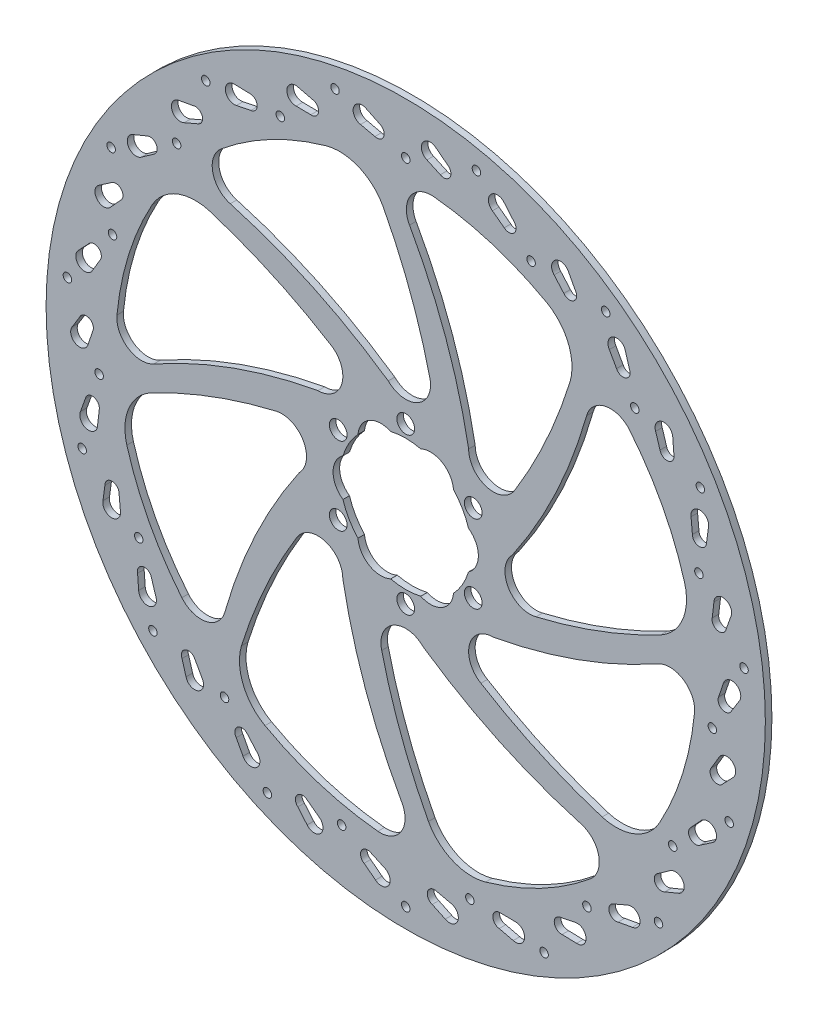
from build123d import *

# Parameters (mm, degrees)
SKETCH1_R      = 101.5
SKETCH1_R_2    = 1.2
SKETCH1_R_3    = 2.5
EXTRUDE1_DEPTH = 1.85


with BuildPart() as part:
    # Sketch1 → Extrude1 (new body)
    with BuildSketch(Plane.XY):
        Circle(SKETCH1_R)
        with Locations((-71.341911819, -64.236540578)):
            Circle(SKETCH1_R_2, mode=Mode.SUBTRACT)
        with Locations((-51.137316949, -70.384478511)):
            Circle(SKETCH1_R_2, mode=Mode.SUBTRACT)
        with BuildLine():
            Line((-61.998078989, -70.824326541), (-63.142973621, -66.919550578))
            ThreePointArc((-63.142973621, -66.919550578), (-62.141111954, -64.27450366), (-59.496065036, -65.276365326))
            Line((-59.496065036, -65.276365326), (-57.459092502, -68.897958465))
            ThreePointArc((-57.459092502, -68.897958465), (-58.475442576, -72.491803952), (-61.927280322, -71.06579237))
            ThreePointArc((-61.927280322, -71.06579237), (-61.965719597, -70.945950777), (-61.998078989, -70.824326541))
        make_face(mode=Mode.SUBTRACT)
        with BuildLine():
            Line((-75.368477695, -56.38651965), (-75.67650506, -52.329035431))
            ThreePointArc((-75.67650506, -52.329035431), (-74.146600297, -49.950087887), (-71.767652754, -51.479992649))
            Line((-71.767652754, -51.479992649), (-70.528164509, -55.445955693))
            ThreePointArc((-70.528164509, -55.445955693), (-72.269507387, -58.749955971), (-75.349429718, -56.637428741))
            ThreePointArc((-75.349429718, -56.637428741), (-75.362112534, -56.512214001), (-75.368477695, -56.38651965))
        make_face(mode=Mode.SUBTRACT)
        with Locations((-39.046724604, -87.700369583)):
            Circle(SKETCH1_R_2, mode=Mode.SUBTRACT)
        with BuildLine():
            Line((-45.918066731, -82.16677051), (-47.849791241, -78.585360248))
            ThreePointArc((-47.849791241, -78.585360248), (-47.419758833, -75.789815199), (-44.624213783, -76.219847607))
            Line((-44.624213783, -76.219847607), (-41.878782433, -79.338789842))
            ThreePointArc((-41.878782433, -79.338789842), (-42.125720327, -83.065412245), (-45.798611616, -82.38823986))
            ThreePointArc((-45.798611616, -82.38823986), (-45.861127369, -82.279009069), (-45.918066731, -82.16677051))
        make_face(mode=Mode.SUBTRACT)
        with BuildLine():
            Line((-27.831214617, -89.918132327), (-30.465343375, -86.816612582))
            ThreePointArc((-30.465343375, -86.816612582), (-30.625934705, -83.992748134), (-27.802070257, -83.832156804))
            Line((-27.802070257, -83.832156804), (-24.468168615, -86.312135394))
            ThreePointArc((-24.468168615, -86.312135394), (-23.934901959, -90.008663432), (-27.668323816, -90.109925926))
            ThreePointArc((-27.668323816, -90.109925926), (-27.752183808, -90.016079845), (-27.831214617, -89.918132327))
        make_face(mode=Mode.SUBTRACT)
        with Locations((-3.977e-06, -96.000007955)):
            Circle(SKETCH1_R_2, mode=Mode.SUBTRACT)
        with BuildLine():
            Line((-8.528004876, -93.739640287), (-11.749413815, -91.253562353))
            ThreePointArc((-11.749413815, -91.253562353), (-12.493610271, -88.524794934), (-9.764842851, -87.780598478))
            Line((-9.764842851, -87.780598478), (-5.988178417, -89.513226458))
            ThreePointArc((-5.988178417, -89.513226458), (-4.698013522, -93.018104117), (-8.328797499, -93.893375834))
            ThreePointArc((-8.328797499, -93.893375834), (-8.430336646, -93.819015988), (-8.528004876, -93.739640287))
        make_face(mode=Mode.SUBTRACT)
        with Locations((-18.088317101, -85.098841264)):
            Circle(SKETCH1_R_2, mode=Mode.SUBTRACT)
        with Locations((-91.301434359, -29.665630135)):
            Circle(SKETCH1_R_2, mode=Mode.SUBTRACT)
        with BuildLine():
            Line((-85.444912268, -39.484351277), (-84.902610091, -35.451490333))
            ThreePointArc((-84.902610091, -35.451490333), (-82.911526413, -33.442613587), (-80.902649666, -35.433697266))
            Line((-80.902649666, -35.433697266), (-80.514817296, -39.570698598))
            ThreePointArc((-80.514817296, -39.570698598), (-82.905047939, -42.440453001), (-85.478447469, -39.7337377))
            ThreePointArc((-85.478447469, -39.7337377), (-85.464819526, -39.608622296), (-85.444912268, -39.484351277))
        make_face(mode=Mode.SUBTRACT)
        with Locations((-75.344210129, -43.5)):
            Circle(SKETCH1_R_2, mode=Mode.SUBTRACT)
        with BuildLine():
            Line((-91.786994165, -20.856527287), (-90.418063654, -17.024544993))
            ThreePointArc((-90.418063654, -17.024544993), (-88.05282097, -15.473536598), (-86.501812575, -17.838779282))
            Line((-86.501812575, -17.838779282), (-86.982586214, -21.966012093))
            ThreePointArc((-86.982586214, -21.966012093), (-89.917240072, -24.276098583), (-91.871646894, -21.093491658))
            ThreePointArc((-91.871646894, -21.093491658), (-91.832303799, -20.973943734), (-91.786994165, -20.856527287))
        make_face(mode=Mode.SUBTRACT)
        with BuildLine():
            Line((-94.117543974, -1.317172973), (-91.981813961, 2.146454656))
            ThreePointArc((-91.981813961, 2.146454656), (-89.345784727, 3.171808191), (-88.320431192, 0.535778957))
            Line((-88.320431192, 0.535778957), (-89.648798725, -3.401305455))
            ThreePointArc((-89.648798725, -3.401305455), (-92.999617344, -5.050762167), (-94.2496145, -1.531358813))
            ThreePointArc((-94.2496145, -1.531358813), (-94.186275736, -1.422603187), (-94.117543974, -1.317172973))
        make_face(mode=Mode.SUBTRACT)
        with Locations((-86.523404897, -9.093976304)):
            Circle(SKETCH1_R_2, mode=Mode.SUBTRACT)
        with BuildLine():
            ThreePointArc((-51.044949255, -49.522858535), (-56.342570087, -54.471101417), (-63.183389209, -52.072541881))
            ThreePointArc((-63.183389209, -52.072541881), (-72.466897056, -38.108255286), (-78.710796809, -22.545526287))
            ThreePointArc((-78.710796809, -22.545526287), (-78.170211393, -13.29412178), (-71.969304687, -6.407215801))
            ThreePointArc((-71.969304687, -6.407215801), (-54.777609064, 1.292105638), (-36.75649861, 6.776039177))
            ThreePointArc((-36.75649861, 6.776039177), (-28.923584542, 3.475240148), (-30.050244577, -4.949749715))
            ThreePointArc((-30.050244577, -4.949749715), (-42.39020698, -26.368402936), (-51.044949255, -49.522858535))
        make_face(mode=Mode.SUBTRACT)
        with BuildLine():
            ThreePointArc((-30.782152671, -21.199386168), (-22.909428641, -17.99469689), (-17.748730128, -24.748733305))
            ThreePointArc((-17.748730128, -24.748733305), (-11.329126286, -48.619679336), (-1.07628067, -71.112178857))
            ThreePointArc((-1.07628067, -71.112178857), (-1.323328187, -78.357098569), (-7.85655549, -81.498250445))
            ThreePointArc((-7.85655549, -81.498250445), (-24.295228587, -78.188440052), (-39.714843653, -71.599032699))
            ThreePointArc((-39.714843653, -71.599032699), (-45.874322902, -64.675050223), (-46.359397641, -55.420569123))
            ThreePointArc((-46.359397641, -55.420569123), (-39.647275485, -37.819962167), (-30.782152671, -21.199386168))
        make_face(mode=Mode.SUBTRACT)
        with Locations((-19.052551994, -10.999996023)):
            Circle(SKETCH1_R_3, mode=Mode.SUBTRACT)
        with BuildLine():
            Line((11.1479196, -93.464276153), (7.480021509, -91.702293567))
            ThreePointArc((7.480021509, -91.702293567), (6.184744883, -89.187883406), (8.699155044, -87.892606779))
            Line((8.699155044, -87.892606779), (12.753523912, -88.802159994))
            ThreePointArc((12.753523912, -88.802159994), (14.744200648, -91.962207302), (11.374737236, -93.573234667))
            ThreePointArc((11.374737236, -93.573234667), (11.259956682, -93.521610938), (11.1479196, -93.464276153))
        make_face(mode=Mode.SUBTRACT)
        with Locations((18.088317101, -85.098841264)):
            Circle(SKETCH1_R_2, mode=Mode.SUBTRACT)
        with BuildLine():
            Line((30.336626496, -89.104074661), (26.382544, -88.143194515))
            ThreePointArc((26.382544, -88.143194515), (24.592797008, -85.953033402), (26.782958121, -84.16328641))
            Line((26.782958121, -84.16328641), (30.937836048, -84.210013017))
            ThreePointArc((30.937836048, -84.210013017), (33.5420225, -86.887120744), (30.581141371, -89.163494131))
            ThreePointArc((30.581141371, -89.163494131), (30.45813587, -89.136862723), (30.336626496, -89.104074661))
        make_face(mode=Mode.SUBTRACT)
        with Locations((39.046717337, -87.700372819)):
            Circle(SKETCH1_R_2, mode=Mode.SUBTRACT)
        with BuildLine():
            Line((48.199477243, -80.849597536), (44.13202272, -80.731814905))
            ThreePointArc((44.13202272, -80.731814905), (41.926025894, -78.96162339), (43.696217409, -76.755626564))
            Line((43.696217409, -76.755626564), (47.770016293, -75.937484388))
            ThreePointArc((47.770016293, -75.937484388), (50.873897017, -78.014650079), (48.451002884, -80.856881048))
            ThreePointArc((48.451002884, -80.856881048), (48.325148368, -80.856405882), (48.199477243, -80.849597536))
        make_face(mode=Mode.SUBTRACT)
        with BuildLine():
            ThreePointArc((-6.776043154, -36.756506565), (-3.475244126, -28.923592497), (4.949745737, -30.050252532))
            ThreePointArc((4.949745737, -30.050252532), (26.368398958, -42.390214935), (49.522854557, -51.04495721))
            ThreePointArc((49.522854557, -51.04495721), (54.47109744, -56.342578042), (52.072537903, -63.183397164))
            ThreePointArc((52.072537903, -63.183397164), (38.108251309, -72.466905011), (22.54552231, -78.710804764))
            ThreePointArc((22.54552231, -78.710804764), (13.294117803, -78.170219348), (6.407211823, -71.969312642))
            ThreePointArc((6.407211823, -71.969312642), (-1.292109616, -54.777617018), (-6.776043154, -36.756506565))
        make_face(mode=Mode.SUBTRACT)
        with Locations((51.137316949, -70.384478511)):
            Circle(SKETCH1_R_2, mode=Mode.SUBTRACT)
        with BuildLine():
            Line((63.955779547, -69.06160504), (59.952720279, -69.792067589))
            ThreePointArc((59.952720279, -69.792067589), (57.426886265, -68.519211536), (58.699742318, -65.993377522))
            Line((58.699742318, -65.993377522), (62.514417599, -64.346123302))
            ThreePointArc((62.514417599, -64.346123302), (65.982338113, -65.73256485), (64.203323077, -69.016434268))
            ThreePointArc((64.203323077, -69.016434268), (64.080119991, -69.042136111), (63.955779547, -69.06160504))
        make_face(mode=Mode.SUBTRACT)
        with Locations((71.341906496, -64.236546489)):
            Circle(SKETCH1_R_2, mode=Mode.SUBTRACT)
        with BuildLine():
            Line((76.916907392, -54.25528901), (73.153196276, -55.80207202))
            ThreePointArc((73.153196276, -55.80207202), (70.417916142, -55.082181346), (71.137806815, -52.346901212))
            Line((71.137806815, -52.346901212), (74.526638879, -49.94252786))
            ThreePointArc((74.526638879, -49.94252786), (78.207034416, -50.577651116), (77.14964997, -54.159638134))
            ThreePointArc((77.14964997, -54.159638134), (77.034482881, -54.210393691), (76.916907392, -54.25528901))
        make_face(mode=Mode.SUBTRACT)
        with Locations((0, -21.999992045)):
            Circle(SKETCH1_R_3, mode=Mode.SUBTRACT)
        with Locations((19.052551994, -10.999996023)):
            Circle(SKETCH1_R_3, mode=Mode.SUBTRACT)
        with BuildLine():
            ThreePointArc((71.599032699, -39.714843653), (64.675050223, -45.874322902), (55.420569123, -46.359397641))
            ThreePointArc((55.420569123, -46.359397641), (37.819962167, -39.647275485), (21.199386168, -30.782152671))
            ThreePointArc((21.199386168, -30.782152671), (17.99469689, -22.909428641), (24.748733305, -17.748730128))
            ThreePointArc((24.748733305, -17.748730128), (48.619679336, -11.329126286), (71.112178857, -1.07628067))
            ThreePointArc((71.112178857, -1.07628067), (78.357098569, -1.323328187), (81.498250445, -7.85655549))
            ThreePointArc((81.498250445, -7.85655549), (78.188440052, -24.295228587), (71.599032699, -39.714843653))
        make_face(mode=Mode.SUBTRACT)
        with Locations((75.344210129, -43.5)):
            Circle(SKETCH1_R_2, mode=Mode.SUBTRACT)
        with BuildLine():
            Line((86.516397295, -37.077756504), (83.156526569, -39.373258136))
            ThreePointArc((83.156526569, -39.373258136), (80.33134518, -39.237795518), (80.466807798, -36.41261413))
            Line((80.466807798, -36.41261413), (83.281688422, -33.356204301))
            ThreePointArc((83.281688422, -33.356204301), (87.013708036, -33.212251331), (86.724166954, -36.935805926))
            ThreePointArc((86.724166954, -36.935805926), (86.622069216, -37.009396937), (86.516397295, -37.077756504))
        make_face(mode=Mode.SUBTRACT)
        with Locations((91.301431901, -29.665637701)):
            Circle(SKETCH1_R_2, mode=Mode.SUBTRACT)
        with BuildLine():
            Line((92.334705485, -18.27974812), (89.52551762, -21.223643937))
            ThreePointArc((89.52551762, -21.223643937), (86.733908962, -21.678529742), (86.279023157, -18.886921084))
            Line((86.279023157, -18.886921084), (88.39692855, -15.312054553))
            ThreePointArc((88.39692855, -15.312054553), (92.017465076, -14.395316792), (92.508421694, -18.097701761))
            ThreePointArc((92.508421694, -18.097701761), (92.423855467, -18.190911946), (92.334705485, -18.27974812))
        make_face(mode=Mode.SUBTRACT)
        with Locations((86.523404897, -9.093976304)):
            Circle(SKETCH1_R_2, mode=Mode.SUBTRACT)
        with Locations((-95.474109451, 10.034737261)):
            Circle(SKETCH1_R_2, mode=Mode.SUBTRACT)
        with BuildLine():
            Line((-92.334705485, 18.27974812), (-89.52551762, 21.223643937))
            ThreePointArc((-89.52551762, 21.223643937), (-86.733908962, 21.678529742), (-86.279023157, 18.886921084))
            Line((-86.279023157, 18.886921084), (-88.39692855, 15.312054553))
            ThreePointArc((-88.39692855, 15.312054553), (-92.017465076, 14.395316792), (-92.508421694, 18.097701761))
            ThreePointArc((-92.508421694, 18.097701761), (-92.423855467, 18.190911946), (-92.334705485, 18.27974812))
        make_face(mode=Mode.SUBTRACT)
        with Locations((-82.741916918, 26.884478511)):
            Circle(SKETCH1_R_2, mode=Mode.SUBTRACT)
        with BuildLine():
            Line((-86.516397295, 37.077756504), (-83.156526569, 39.373258136))
            ThreePointArc((-83.156526569, 39.373258136), (-80.33134518, 39.237795518), (-80.466807798, 36.41261413))
            Line((-80.466807798, 36.41261413), (-83.281688422, 33.356204301))
            ThreePointArc((-83.281688422, 33.356204301), (-87.013708036, 33.212251331), (-86.724166954, 36.935805926))
            ThreePointArc((-86.724166954, 36.935805926), (-86.622069216, 37.009396937), (-86.516397295, 37.077756504))
        make_face(mode=Mode.SUBTRACT)
        with Locations((-83.138443664, 48.000007422)):
            Circle(SKETCH1_R_2, mode=Mode.SUBTRACT)
        with BuildLine():
            ThreePointArc((-71.599036677, 39.714839676), (-64.675054201, 45.874318924), (-55.4205731, 46.359393663))
            ThreePointArc((-55.4205731, 46.359393663), (-37.819966145, 39.647271507), (-21.199390146, 30.782148694))
            ThreePointArc((-21.199390146, 30.782148694), (-17.994700868, 22.909424663), (-24.748737282, 17.748726151))
            ThreePointArc((-24.748737282, 17.748726151), (-48.619683314, 11.329122309), (-71.112182835, 1.076276692))
            ThreePointArc((-71.112182835, 1.076276692), (-78.357102546, 1.32332421), (-81.498254423, 7.856551513))
            ThreePointArc((-81.498254423, 7.856551513), (-78.188444029, 24.29522461), (-71.599036677, 39.714839676))
        make_face(mode=Mode.SUBTRACT)
        with Locations((-19.052551994, 10.999996023)):
            Circle(SKETCH1_R_3, mode=Mode.SUBTRACT)
        with Locations((0, 21.999992045)):
            Circle(SKETCH1_R_3, mode=Mode.SUBTRACT)
        with BuildLine():
            Line((-76.916907392, 54.25528901), (-73.153196276, 55.80207202))
            ThreePointArc((-73.153196276, 55.80207202), (-70.417916142, 55.082181346), (-71.137806815, 52.346901212))
            Line((-71.137806815, 52.346901212), (-74.526638879, 49.94252786))
            ThreePointArc((-74.526638879, 49.94252786), (-78.207034416, 50.577651116), (-77.14964997, 54.159638134))
            ThreePointArc((-77.14964997, 54.159638134), (-77.034482881, 54.210393691), (-76.916907392, 54.25528901))
        make_face(mode=Mode.SUBTRACT)
        with Locations((-64.653599817, 58.214362753)):
            Circle(SKETCH1_R_2, mode=Mode.SUBTRACT)
        with BuildLine():
            Line((-63.955779547, 69.06160504), (-59.952720279, 69.792067589))
            ThreePointArc((-59.952720279, 69.792067589), (-57.426886265, 68.519211536), (-58.699742318, 65.993377522))
            Line((-58.699742318, 65.993377522), (-62.514417599, 64.346123302))
            ThreePointArc((-62.514417599, 64.346123302), (-65.982338113, 65.73256485), (-64.203323077, 69.016434268))
            ThreePointArc((-64.203323077, 69.016434268), (-64.080119991, 69.042136111), (-63.955779547, 69.06160504))
        make_face(mode=Mode.SUBTRACT)
        with Locations((-56.427385678, 77.665640234)):
            Circle(SKETCH1_R_2, mode=Mode.SUBTRACT)
        with BuildLine():
            ThreePointArc((-4.949749715, 30.050244577), (-26.368402936, 42.39020698), (-49.522858535, 51.044949255))
            ThreePointArc((-49.522858535, 51.044949255), (-54.471101417, 56.342570087), (-52.072541881, 63.183389209))
            ThreePointArc((-52.072541881, 63.183389209), (-38.108255286, 72.466897056), (-22.545526287, 78.710796809))
            ThreePointArc((-22.545526287, 78.710796809), (-13.29412178, 78.170211393), (-6.407215801, 71.969304687))
            ThreePointArc((-6.407215801, 71.969304687), (1.292105638, 54.777609064), (6.776039177, 36.75649861))
            ThreePointArc((6.776039177, 36.75649861), (3.475240148, 28.923584542), (-4.949749715, 30.050244577))
        make_face(mode=Mode.SUBTRACT)
        with BuildLine():
            Line((-48.199477243, 80.849597536), (-44.13202272, 80.731814905))
            ThreePointArc((-44.13202272, 80.731814905), (-41.926025894, 78.96162339), (-43.696217409, 76.755626564))
            Line((-43.696217409, 76.755626564), (-47.770016293, 75.937484388))
            ThreePointArc((-47.770016293, 75.937484388), (-50.873897017, 78.014650079), (-48.451002884, 80.856881048))
            ThreePointArc((-48.451002884, 80.856881048), (-48.325148368, 80.856405882), (-48.199477243, 80.849597536))
        make_face(mode=Mode.SUBTRACT)
        with Locations((-35.386087948, 79.478454815)):
            Circle(SKETCH1_R_2, mode=Mode.SUBTRACT)
        with BuildLine():
            Line((-30.336626496, 89.104074661), (-26.382544, 88.143194515))
            ThreePointArc((-26.382544, 88.143194515), (-24.592797008, 85.953033402), (-26.782958121, 84.16328641))
            Line((-26.782958121, 84.16328641), (-30.937836048, 84.210013017))
            ThreePointArc((-30.937836048, 84.210013017), (-33.5420225, 86.887120744), (-30.581141371, 89.163494131))
            ThreePointArc((-30.581141371, 89.163494131), (-30.45813587, 89.136862723), (-30.336626496, 89.104074661))
        make_face(mode=Mode.SUBTRACT)
        with Locations((-19.959520082, 93.902178279)):
            Circle(SKETCH1_R_2, mode=Mode.SUBTRACT)
        with BuildLine():
            Line((-11.1479196, 93.464276153), (-7.480021509, 91.702293567))
            ThreePointArc((-7.480021509, 91.702293567), (-6.184744883, 89.187883406), (-8.699155044, 87.892606779))
            Line((-8.699155044, 87.892606779), (-12.753523912, 88.802159994))
            ThreePointArc((-12.753523912, 88.802159994), (-14.744200648, 91.962207302), (-11.374737236, 93.573234667))
            ThreePointArc((-11.374737236, 93.573234667), (-11.259956682, 93.521610938), (-11.1479196, 93.464276153))
        make_face(mode=Mode.SUBTRACT)
        with BuildLine():
            ThreePointArc((-13.476725627, 12.673901212), (-10.249996145, 17.753516729), (-4.237555108, 18.008133549))
            ThreePointArc((-4.237555108, 18.008133549), (-3.179e-06, 18.499992045), (4.237548707, 18.008133183))
            ThreePointArc((4.237548707, 18.008133183), (10.249995223, 17.753517262), (13.47672378, 12.673894717))
            ThreePointArc((13.47672378, 12.673894717), (16.021463354, 9.249996615), (17.714278537, 5.334239413))
            ThreePointArc((17.714278537, 5.334239413), (20.499994567, 5.825e-06), (17.714285709, -5.334231508))
            ThreePointArc((17.714285709, -5.334231508), (16.021469992, -9.250001027), (13.476724932, -12.673909402))
            ThreePointArc((13.476724932, -12.673909402), (10.250002114, -17.753513283), (4.237575025, -18.0081429))
            ThreePointArc((4.237575025, -18.0081429), (6.68e-07, -18.500007955), (-4.237573936, -18.008145028))
            ThreePointArc((-4.237573936, -18.008145028), (-10.249995651, -17.753517014), (-13.476721507, -12.673921503))
            ThreePointArc((-13.476721507, -12.673921503), (-16.021474662, -9.250006717), (-17.714294665, -5.334228183))
            ThreePointArc((-17.714294665, -5.334228183), (-20.499994567, 1.562e-06), (-17.714289712, 5.33422872))
            ThreePointArc((-17.714289712, 5.33422872), (-16.021471872, 9.24999564), (-13.476725627, 12.673901212))
        make_face(mode=Mode.SUBTRACT)
        with Locations((19.052551994, 10.999996023)):
            Circle(SKETCH1_R_3, mode=Mode.SUBTRACT)
        with BuildLine():
            ThreePointArc((30.782152671, 21.199386168), (22.909428641, 17.99469689), (17.748730128, 24.748733305))
            ThreePointArc((17.748730128, 24.748733305), (11.329126286, 48.619679336), (1.07628067, 71.112178857))
            ThreePointArc((1.07628067, 71.112178857), (1.323328187, 78.357098569), (7.85655549, 81.498250445))
            ThreePointArc((7.85655549, 81.498250445), (24.295228587, 78.188440052), (39.714843653, 71.599032699))
            ThreePointArc((39.714843653, 71.599032699), (45.874322902, 64.675050223), (46.359397641, 55.420569123))
            ThreePointArc((46.359397641, 55.420569123), (39.647275485, 37.819962167), (30.782152671, 21.199386168))
        make_face(mode=Mode.SUBTRACT)
        with BuildLine():
            ThreePointArc((63.183389209, 52.072541881), (72.466897056, 38.108255286), (78.710796809, 22.545526287))
            ThreePointArc((78.710796809, 22.545526287), (78.170211393, 13.29412178), (71.969304687, 6.407215801))
            ThreePointArc((71.969304687, 6.407215801), (54.777609064, -1.292105638), (36.75649861, -6.776039177))
            ThreePointArc((36.75649861, -6.776039177), (28.923584542, -3.475240148), (30.050244577, 4.949749715))
            ThreePointArc((30.050244577, 4.949749715), (42.39020698, 26.368402936), (51.044949255, 49.522858535))
            ThreePointArc((51.044949255, 49.522858535), (56.342570087, 54.471101417), (63.183389209, 52.072541881))
        make_face(mode=Mode.SUBTRACT)
        with BuildLine():
            Line((94.117543974, 1.317172973), (91.981813961, -2.146454656))
            ThreePointArc((91.981813961, -2.146454656), (89.345784727, -3.171808191), (88.320431192, -0.535778957))
            Line((88.320431192, -0.535778957), (89.648798725, 3.401305455))
            ThreePointArc((89.648798725, 3.401305455), (92.999617344, 5.050762167), (94.2496145, 1.531358813))
            ThreePointArc((94.2496145, 1.531358813), (94.186275736, 1.422603187), (94.117543974, 1.317172973))
        make_face(mode=Mode.SUBTRACT)
        with Locations((95.474110282, 10.03472935)):
            Circle(SKETCH1_R_2, mode=Mode.SUBTRACT)
        with BuildLine():
            Line((91.786994165, 20.856527287), (90.418063654, 17.024544993))
            ThreePointArc((90.418063654, 17.024544993), (88.05282097, 15.473536598), (86.501812575, 17.838779282))
            Line((86.501812575, 17.838779282), (86.982586214, 21.966012093))
            ThreePointArc((86.982586214, 21.966012093), (89.917240072, 24.276098583), (91.871646894, 21.093491658))
            ThreePointArc((91.871646894, 21.093491658), (91.832303799, 20.973943734), (91.786994165, 20.856527287))
        make_face(mode=Mode.SUBTRACT)
        with Locations((82.741916918, 26.884478511)):
            Circle(SKETCH1_R_2, mode=Mode.SUBTRACT)
        with BuildLine():
            Line((85.444912268, 39.484351277), (84.902610091, 35.451490333))
            ThreePointArc((84.902610091, 35.451490333), (82.911526413, 33.442613587), (80.902649666, 35.433697266))
            Line((80.902649666, 35.433697266), (80.514817296, 39.570698598))
            ThreePointArc((80.514817296, 39.570698598), (82.905047939, 42.440453001), (85.478447469, 39.7337377))
            ThreePointArc((85.478447469, 39.7337377), (85.464819526, 39.608622296), (85.444912268, 39.484351277))
        make_face(mode=Mode.SUBTRACT)
        with Locations((83.138447641, 48.000000533)):
            Circle(SKETCH1_R_2, mode=Mode.SUBTRACT)
        with Locations((0, 87)):
            Circle(SKETCH1_R_2, mode=Mode.SUBTRACT)
        with BuildLine():
            Line((8.528004876, 93.739640287), (11.749413815, 91.253562353))
            ThreePointArc((11.749413815, 91.253562353), (12.493610271, 88.524794934), (9.764842851, 87.780598478))
            Line((9.764842851, 87.780598478), (5.988178417, 89.513226458))
            ThreePointArc((5.988178417, 89.513226458), (4.698013522, 93.018104117), (8.328797499, 93.893375834))
            ThreePointArc((8.328797499, 93.893375834), (8.430336646, 93.819015988), (8.528004876, 93.739640287))
        make_face(mode=Mode.SUBTRACT)
        with Locations((19.959527863, 93.902176625)):
            Circle(SKETCH1_R_2, mode=Mode.SUBTRACT)
        with Locations((35.386087948, 79.478454815)):
            Circle(SKETCH1_R_2, mode=Mode.SUBTRACT)
        with BuildLine():
            Line((27.831214617, 89.918132327), (30.465343375, 86.816612582))
            ThreePointArc((30.465343375, 86.816612582), (30.625934705, 83.992748134), (27.802070257, 83.832156804))
            Line((27.802070257, 83.832156804), (24.468168615, 86.312135394))
            ThreePointArc((24.468168615, 86.312135394), (23.934901959, 90.008663432), (27.668323816, 90.109925926))
            ThreePointArc((27.668323816, 90.109925926), (27.752183808, 90.016079845), (27.831214617, 89.918132327))
        make_face(mode=Mode.SUBTRACT)
        with BuildLine():
            Line((45.918066731, 82.16677051), (47.849791241, 78.585360248))
            ThreePointArc((47.849791241, 78.585360248), (47.419758833, 75.789815199), (44.624213783, 76.219847607))
            Line((44.624213783, 76.219847607), (41.878782433, 79.338789842))
            ThreePointArc((41.878782433, 79.338789842), (42.125720327, 83.065412245), (45.798611616, 82.38823986))
            ThreePointArc((45.798611616, 82.38823986), (45.861127369, 82.279009069), (45.918066731, 82.16677051))
        make_face(mode=Mode.SUBTRACT)
        with BuildLine():
            Line((75.368477695, 56.38651965), (75.67650506, 52.329035431))
            ThreePointArc((75.67650506, 52.329035431), (74.146600297, 49.950087887), (71.767652754, 51.479992649))
            Line((71.767652754, 51.479992649), (70.528164509, 55.445955693))
            ThreePointArc((70.528164509, 55.445955693), (72.269507387, 58.749955971), (75.349429718, 56.637428741))
            ThreePointArc((75.349429718, 56.637428741), (75.362112534, 56.512214001), (75.368477695, 56.38651965))
        make_face(mode=Mode.SUBTRACT)
        with Locations((64.653599817, 58.214362753)):
            Circle(SKETCH1_R_2, mode=Mode.SUBTRACT)
        with BuildLine():
            Line((61.998078989, 70.824326541), (63.142973621, 66.919550578))
            ThreePointArc((63.142973621, 66.919550578), (62.141111954, 64.27450366), (59.496065036, 65.276365326))
            Line((59.496065036, 65.276365326), (57.459092502, 68.897958465))
            ThreePointArc((57.459092502, 68.897958465), (58.475442576, 72.491803952), (61.927280322, 71.06579237))
            ThreePointArc((61.927280322, 71.06579237), (61.965719597, 70.945950777), (61.998078989, 70.824326541))
        make_face(mode=Mode.SUBTRACT)
        with Locations((56.427392114, 77.665635558)):
            Circle(SKETCH1_R_2, mode=Mode.SUBTRACT)
    extrude(amount=EXTRUDE1_DEPTH)


solid = part.part
